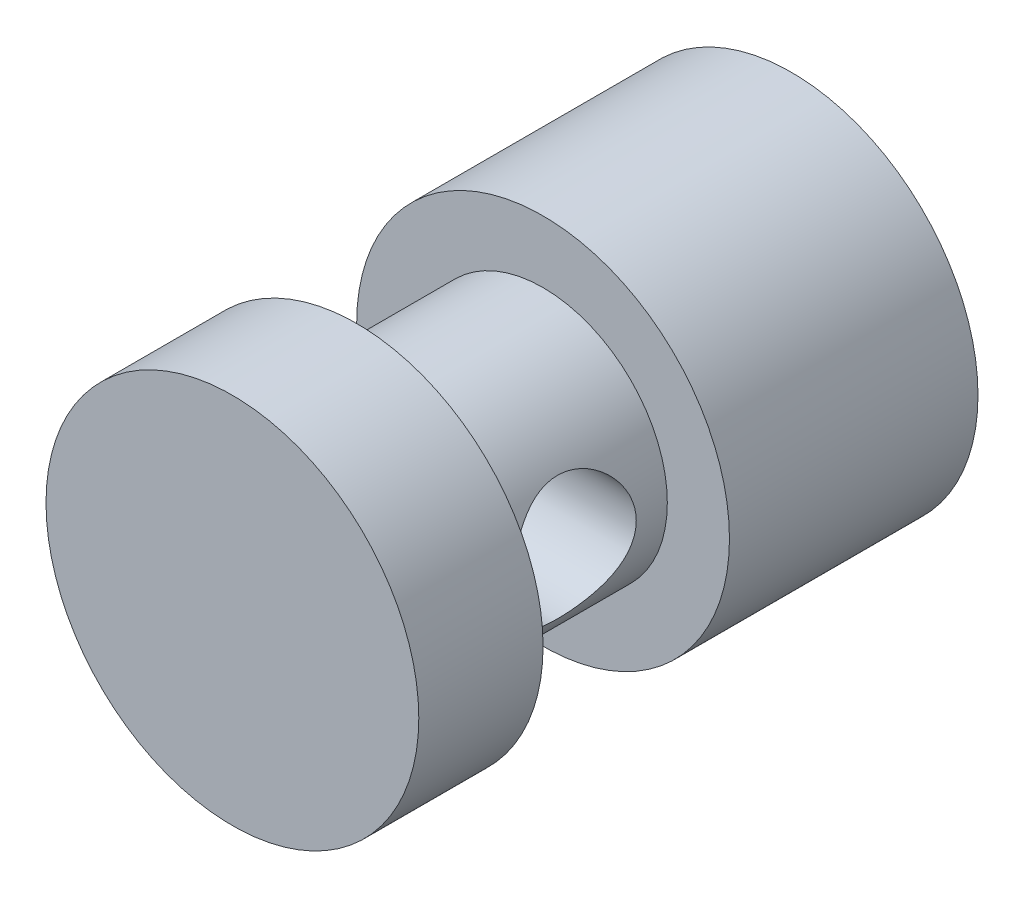
from build123d import *

# Parameters (mm, degrees)
SKETCH_2_R          = 3
EXTRUDE_1_DEPTH     = 4
SKETCH_3_R          = 2
EXTRUDE_2_DEPTH     = 3
SKETCH_4_R          = 1
CUT_EXTRUDE_1_DEPTH = 10.110433579
SKETCH_5_R          = 3
EXTRUDE_3_DEPTH     = 2


with BuildPart() as part:
    # 草图2 → 凸台-拉伸1 (new body)
    with BuildSketch(Plane.XY):
        Circle(SKETCH_2_R)
    extrude(amount=EXTRUDE_1_DEPTH)

    # 草图3 → 凸台-拉伸2 (add)
    with BuildSketch(Plane.XY.offset(4)):
        Circle(SKETCH_3_R)
    extrude(amount=EXTRUDE_2_DEPTH)

    # 草图4 → 切除-拉伸1 (cut, through all)
    with BuildSketch(Plane(origin=(2, 0, 0), x_dir=(0, 0, -1), z_dir=(1, 0, 0))):
        with Locations(Location((-5.5, 0, 0), (0, 0, 180))):
            Circle(SKETCH_4_R)
    extrude(amount=-CUT_EXTRUDE_1_DEPTH, mode=Mode.SUBTRACT)

    # 草图5 → 凸台-拉伸3 (add)
    with BuildSketch(Plane.XY.offset(7)):
        Circle(SKETCH_5_R)
    extrude(amount=EXTRUDE_3_DEPTH)


solid = part.part
